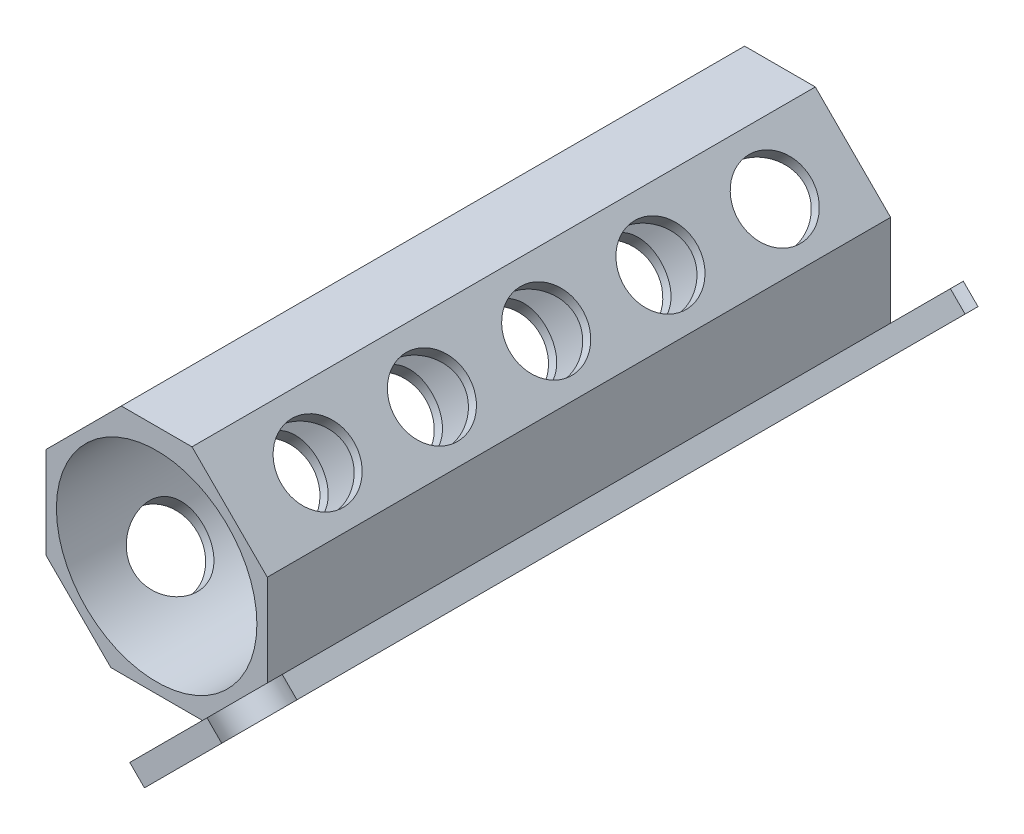
from build123d import *

# Parameters (mm, degrees)
SKIZZE1_R                        = 9.65
AUFSATZ_LINEAR_AUSTRAGEN1_DEPTH  = 60
SKIZZE9_R                        = 3.5
SCHNITT_LINEAR_AUSTRAGEN8_DEPTH  = 66.276908441
SKIZZE13_W                       = 19
SKIZZE13_H                       = 72.8
AUFSATZ_LINEAR_AUSTRAGEN2_DEPTH  = 2
SKIZZE14_R                       = 3
SCHNITT_LINEAR_AUSTRAGEN12_DEPTH = 2


with BuildPart() as part:
    # Skizze1 → Aufsatz-Linear austragen1 (new body)
    with BuildSketch(Plane(origin=(0, 0, 0), x_dir=(0, 1, 0), z_dir=(0, 0, 1))):
        Polygon((11.65888225, 3.402492189), (11.65888225, -3.402492189), (4.411374439, -10.65), (-4.411374439, -10.65), (-10.65, -4.411374439), (-10.65, 4.411374439), (-4.411374439, 10.65), (4.411374439, 10.65), align=None)
        with Locations(Location((0, 0, 0), (0, 0, 270))):
            Circle(SKIZZE1_R, mode=Mode.SUBTRACT)
    extrude(amount=AUFSATZ_LINEAR_AUSTRAGEN1_DEPTH)

    # Skizze9 → Schnitt-Linear austragen8 (cut, through all)
    with BuildSketch(Plane(origin=(7.53068722, 7.53068722, 0), x_dir=(-0.7071067811865476, 0.7071067811865475, 0), z_dir=(0.7071067811865475, 0.7071067811865476, 0))):
        with Locations((0.613513233, 51.6)):
            Circle(SKIZZE9_R)
        with Locations((0.613513233, 40.6)):
            Circle(SKIZZE9_R)
        with Locations((0.613513233, 29.6)):
            Circle(SKIZZE9_R)
        with Locations((0.613513233, 18.6)):
            Circle(SKIZZE9_R)
        with Locations((0.613513233, 7.6)):
            Circle(SKIZZE9_R)
    extrude(amount=-SCHNITT_LINEAR_AUSTRAGEN8_DEPTH, mode=Mode.SUBTRACT)

    # Skizze13 → Aufsatz-Linear austragen2 (add)
    with BuildSketch(Plane(origin=(7.53068722, -7.53068722, 0), x_dir=(0.7071067811865477, 0.7071067811865475, 0), z_dir=(0.7071067811865475, -0.7071067811865477, 0))):
        with Locations((0, 30)):
            Rectangle(SKIZZE13_W, SKIZZE13_H)
    extrude(amount=AUFSATZ_LINEAR_AUSTRAGEN2_DEPTH)

    # Skizze14 → Schnitt-Linear austragen12 (cut)
    with BuildSketch(Plane(origin=(8.944900782, -8.944900782, 0), x_dir=(0.7071067811865478, 0.7071067811865474, 0), z_dir=(0.7071067811865474, -0.7071067811865478, 0))):
        with Locations((7.38, 64.28)):
            Circle(SKIZZE14_R)
        with Locations((-7.38, -4.28)):
            Circle(SKIZZE14_R)
        with Locations((7.38, -4.28)):
            Circle(SKIZZE14_R)
        with Locations((-7.38, 64.28)):
            Circle(SKIZZE14_R)
    extrude(amount=-SCHNITT_LINEAR_AUSTRAGEN12_DEPTH, mode=Mode.SUBTRACT)


solid = part.part
